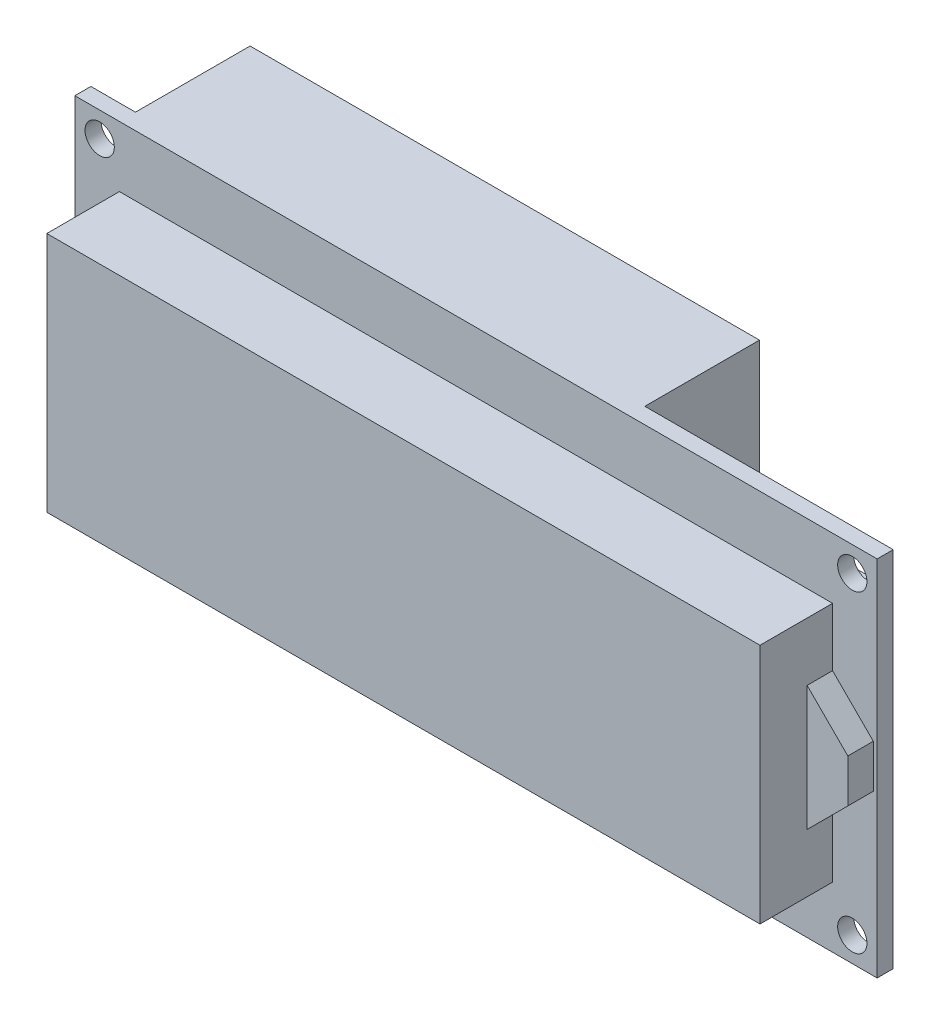
from build123d import *

# Parameters (mm, degrees)
SKETCH2_W           = 80.01
SKETCH2_H           = 36.195
BOSS_EXTRUDE1_DEPTH = 1.6002
SKETCH3_W           = 71.12
SKETCH3_H           = 24.0792
BOSS_EXTRUDE2_DEPTH = 7.239
SKETCH4_R           = 1.4605
CUT_EXTRUDE1_DEPTH  = 1.6002
BOSS_EXTRUDE3_DEPTH = 2.54
SKETCH6_W           = 50.8
SKETCH6_H           = 6.0325
SKETCH6_H_2         = 13.7795
BOSS_EXTRUDE5_DEPTH = 2.54
SKETCH9_W           = 50.8
SKETCH9_H           = 19.812
BOSS_EXTRUDE6_DEPTH = 8.89


with BuildPart() as part:
    # Sketch2 → Boss-Extrude1 (new body)
    with BuildSketch(Plane.XY):
        Rectangle(SKETCH2_W, SKETCH2_H)
    extrude(amount=BOSS_EXTRUDE1_DEPTH)

    # Sketch3 → Boss-Extrude2 (add)
    with BuildSketch(Plane.XY.offset(1.6002)):
        Rectangle(SKETCH3_W, SKETCH3_H)
    extrude(amount=BOSS_EXTRUDE2_DEPTH)

    # Sketch4 → Cut-Extrude1 (cut)
    with BuildSketch(Plane.XY.offset(1.6002)):
        with Locations((-37.5285, 15.621)):
            Circle(SKETCH4_R)
        with Locations(Location((37.5285, 15.621, 0), (0, 0, 180))):
            Circle(SKETCH4_R)
        with Locations((37.5285, -15.621)):
            Circle(SKETCH4_R)
        with Locations(Location((-37.5285, -15.621, 0), (0, 0, 180))):
            Circle(SKETCH4_R)
    extrude(amount=-CUT_EXTRUDE1_DEPTH, mode=Mode.SUBTRACT)

    # Sketch5 → Boss-Extrude3 (add)
    with BuildSketch(Plane.XY.offset(1.6002)):
        Polygon((35.56, 6.223), (39.624, 2.159), (39.624, -2.159), (35.56, -6.223), align=None)
    extrude(amount=BOSS_EXTRUDE3_DEPTH)

    # Sketch6 → Boss-Extrude5 (add)
    with BuildSketch(Plane(origin=(0, 0, 0), x_dir=(-1, 0, 0), z_dir=(0, 0, -1))):
        with Locations((10.16, 15.08125)):
            Rectangle(SKETCH6_W, SKETCH6_H)
        with Locations((10.16, 5.17525)):
            Rectangle(SKETCH6_W, SKETCH6_H_2)
        Polygon((-15.24, 12.065), (-35.56, 12.065), (-35.56, -12.065), (35.56, -12.065), (35.56, -1.7145), (-15.24, -1.7145), align=None)
    extrude(amount=BOSS_EXTRUDE5_DEPTH)

    # Sketch9 → Boss-Extrude6 (add)
    with BuildSketch(Plane(origin=(0, 0, -2.54), x_dir=(-1, 0, 0), z_dir=(0, 0, -1))):
        with Locations((10.16, 8.1915)):
            Rectangle(SKETCH9_W, SKETCH9_H)
    extrude(amount=BOSS_EXTRUDE6_DEPTH)


solid = part.part
